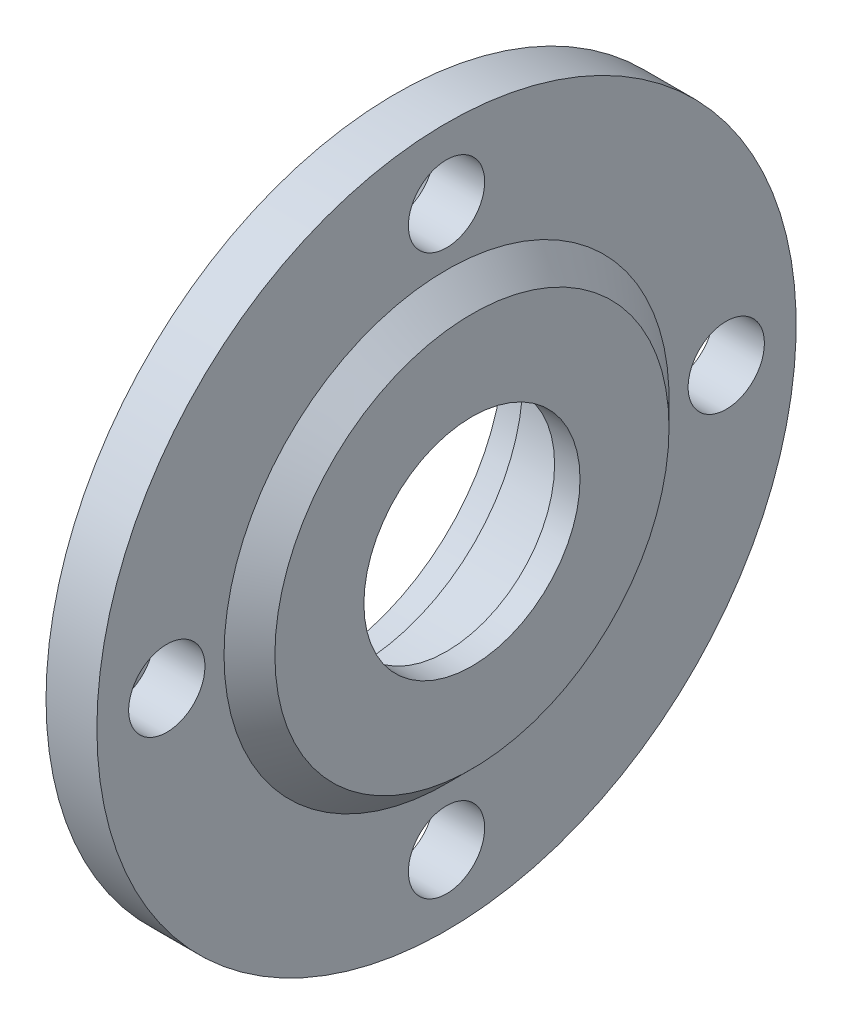
from build123d import *

# Parameters (mm, degrees)
SKETCH3_R          = 3
CUT_EXTRUDE1_DEPTH = 41.155946011


with BuildPart() as part:
    # Sketch2 → Revolve1 (revolve)
    with BuildSketch(Plane(origin=(0, 0, 0), x_dir=(1, 0, 0), z_dir=(0, 1, 0)), mode=Mode.PRIVATE) as revolve1_sk:
        Polygon((18.892201274, 8.5), (20.892201274, 8.5), (20.892201274, 15.5), (18.892201274, 17.5), (18.892201274, 27.5), (14.892201274, 27.5), (14.892201274, 17.5), (8.892201274, 17.5), (8.892201274, 14.5), (11.892201274, 14.5), (11.892201274, 13), (18.892201274, 13), align=None)
    revolve(revolve1_sk.sketch.rotate(Axis((0, 0, 0), (1, 0, 0)), 180), axis=Axis((0, 0, 0), (1, 0, 0)))

    # Sketch3 → Cut-Extrude1 (cut, through all)
    with BuildSketch(Plane(origin=(18.892201274, 0, 0), x_dir=(0, 0, -1), z_dir=(1, 0, 0))):
        with Locations((0, 22)):
            Circle(SKETCH3_R)
        with Locations((22, 0)):
            Circle(SKETCH3_R)
        with Locations((0, -22)):
            Circle(SKETCH3_R)
        with Locations((-22, 0)):
            Circle(SKETCH3_R)
    extrude(amount=-CUT_EXTRUDE1_DEPTH, mode=Mode.SUBTRACT)


solid = part.part
